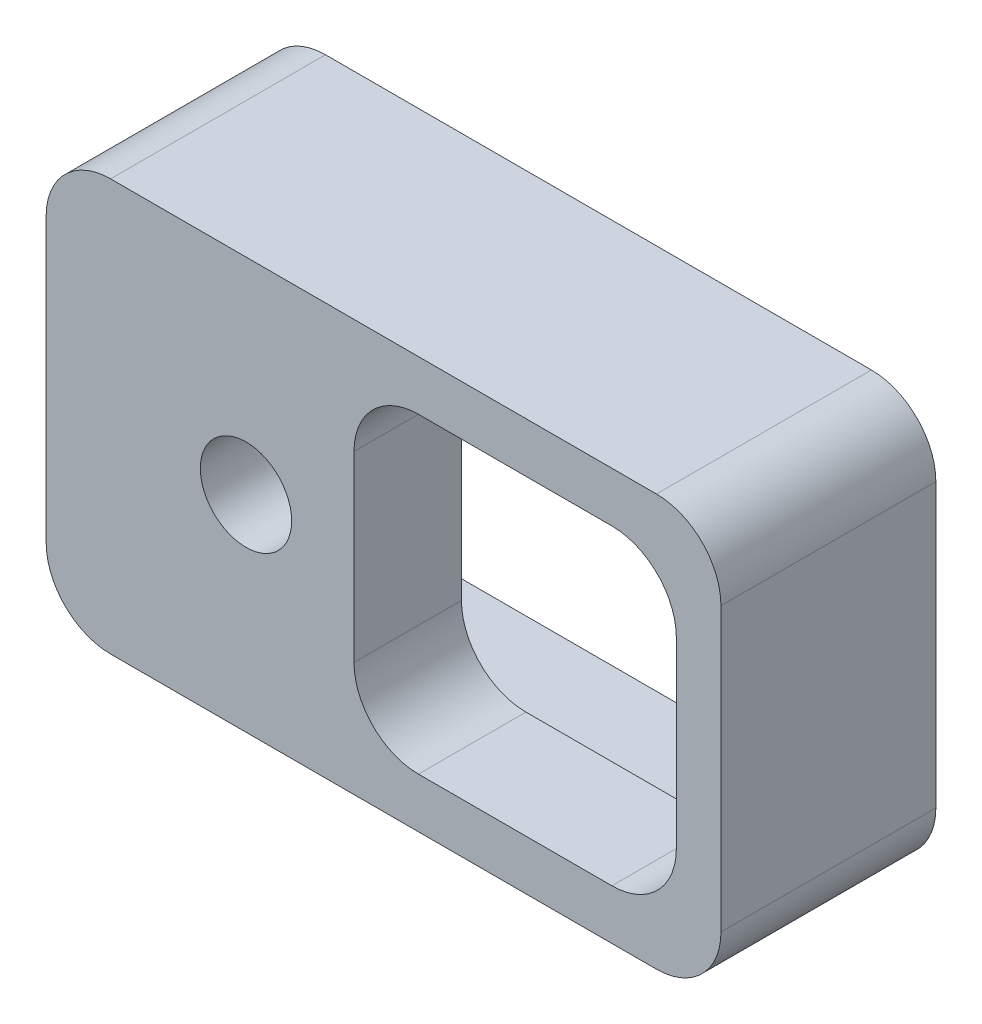
from build123d import *

# Parameters (mm, degrees)
SKETCH2_W           = 62.8
SKETCH2_H           = 38.3
SKETCH2_W_2         = 30
SKETCH2_H_2         = 29
SKETCH2_R           = 4.25
BOSS_EXTRUDE1_DEPTH = 10
SKETCH2_3_W         = 62.8
SKETCH2_3_H         = 38.3
SKETCH2_3_W_2       = 58
SKETCH2_3_H_2       = 33.5
BOSS_EXTRUDE2_DEPTH = 10
SKETCH2_4_R         = 6.5
CUT_EXTRUDE1_DEPTH  = 3
FILLET1_R           = 3.6
FILLET2_R           = 6


with BuildPart() as part:
    # Sketch2 → Boss-Extrude1 (new body)
    with BuildSketch(Plane.XY):
        with Locations((29, -16.75)):
            Rectangle(SKETCH2_W, SKETCH2_H)
        with Locations((41.25, -16.75)):
            Rectangle(SKETCH2_W_2, SKETCH2_H_2, mode=Mode.SUBTRACT)
        with Locations((16.2, -16.75)):
            Circle(SKETCH2_R, mode=Mode.SUBTRACT)
    extrude(amount=BOSS_EXTRUDE1_DEPTH)

    # Sketch2<3> → Boss-Extrude2 (add)
    with BuildSketch(Plane.XY):
        with Locations((29, -16.75)):
            Rectangle(SKETCH2_3_W, SKETCH2_3_H)
        with Locations((29, -16.75)):
            Rectangle(SKETCH2_3_W_2, SKETCH2_3_H_2, mode=Mode.SUBTRACT)
    extrude(amount=-BOSS_EXTRUDE2_DEPTH)

    # Sketch2<4> → Cut-Extrude1 (cut)
    with BuildSketch(Plane.XY):
        with Locations((14.45, -16.75)):
            Circle(SKETCH2_4_R)
    extrude(amount=CUT_EXTRUDE1_DEPTH, mode=Mode.SUBTRACT)

    # Fillet1
    fillet1_edges = [part.edges().sort_by_distance(p)[0] for p in [
        (58, -33.5, -5),
        (0, -33.5, -5),
        (0, 0, -5),
        (58, 0, -5),
    ]]
    fillet(fillet1_edges, radius=FILLET1_R)

    # Fillet2
    fillet2_edges = [part.edges().sort_by_distance(p)[0] for p in [
        (56.25, -31.25, 5),
        (26.25, -31.25, 5),
        (26.25, -2.25, 5),
        (56.25, -2.25, 5),
        (60.4, -35.9, 0),
        (-2.4, -35.9, 0),
        (-2.4, 2.4, 0),
        (60.4, 2.4, 0),
    ]]
    fillet(fillet2_edges, radius=FILLET2_R)


solid = part.part
